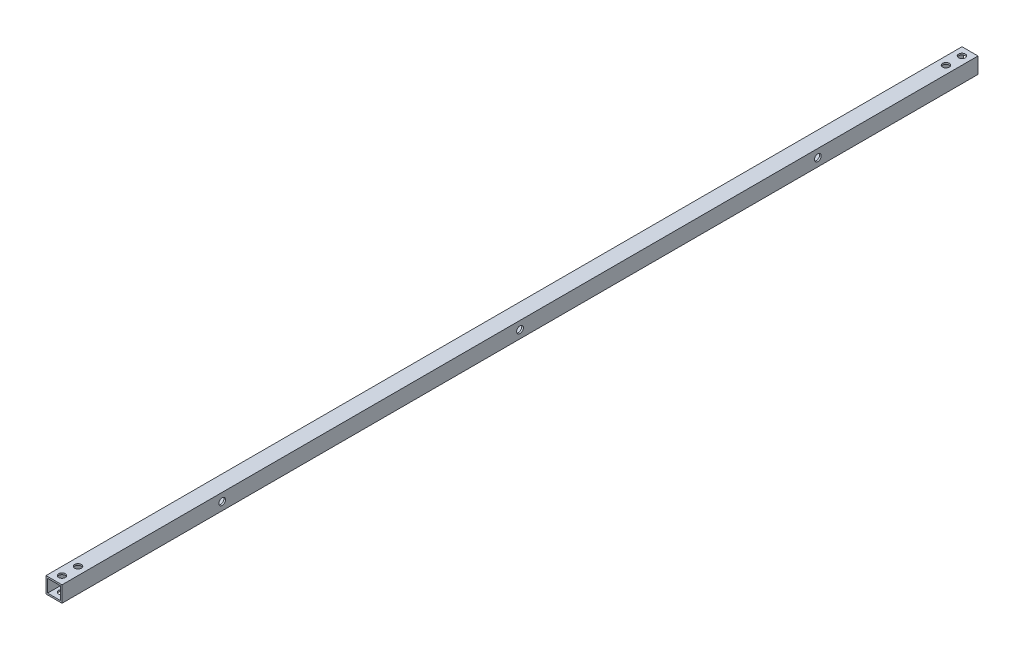
from build123d import *

# Parameters (mm, degrees)
SKETCH1_W           = 10
SKETCH1_H           = 10
SKETCH1_W_2         = 8
SKETCH1_H_2         = 8
BOSS_EXTRUDE1_DEPTH = 572
SKETCH2_R           = 2.1
CUT_EXTRUDE1_DEPTH  = 116
SKETCH3_R           = 2.1
CUT_EXTRUDE2_DEPTH  = 5
SKETCH5_R           = 2.1
CUT_EXTRUDE3_DEPTH  = 10


with BuildPart() as part:
    # Sketch1 → Boss-Extrude1 (new body)
    with BuildSketch(Plane.XY):
        with Locations((5, 5)):
            Rectangle(SKETCH1_W, SKETCH1_H)
        with Locations((5, 5)):
            Rectangle(SKETCH1_W_2, SKETCH1_H_2, mode=Mode.SUBTRACT)
    extrude(amount=BOSS_EXTRUDE1_DEPTH)

    # Sketch2 → Cut-Extrude1 (cut)
    with BuildSketch(Plane(origin=(0, 10, 0), x_dir=(1, 0, 0), z_dir=(0, 1, 0))):
        with Locations(Location((5, -5, 0), (0, 0, 270))):
            Circle(SKETCH2_R)
        with Locations(Location((5, -15, 0), (0, 0, 270))):
            Circle(SKETCH2_R)
        with Locations(Location((5, -557, 0), (0, 0, 270))):
            Circle(SKETCH2_R)
        with Locations(Location((5, -567, 0), (0, 0, 270))):
            Circle(SKETCH2_R)
    extrude(amount=-CUT_EXTRUDE1_DEPTH, mode=Mode.SUBTRACT)

    # Sketch3 → Cut-Extrude2 (cut)
    with BuildSketch(Plane.XZ):
        with Locations(Location((5, 336, 0), (0, 0, 270))):
            Circle(SKETCH3_R)
        with Locations(Location((5, 236, 0), (0, 0, 270))):
            Circle(SKETCH3_R)
    extrude(amount=-CUT_EXTRUDE2_DEPTH, mode=Mode.SUBTRACT)

    # Sketch5 → Cut-Extrude3 (cut)
    with BuildSketch(Plane(origin=(10, 0, 0), x_dir=(0, 0, -1), z_dir=(1, 0, 0))):
        with Locations(Location((-472, 5, 0), (0, 0, 90))):
            Circle(SKETCH5_R)
        with Locations(Location((-100, 5, 0), (0, 0, 90))):
            Circle(SKETCH5_R)
        with Locations(Location((-286, 5, 0), (0, 0, 90))):
            Circle(SKETCH5_R)
    extrude(amount=-CUT_EXTRUDE3_DEPTH, mode=Mode.SUBTRACT)


solid = part.part
